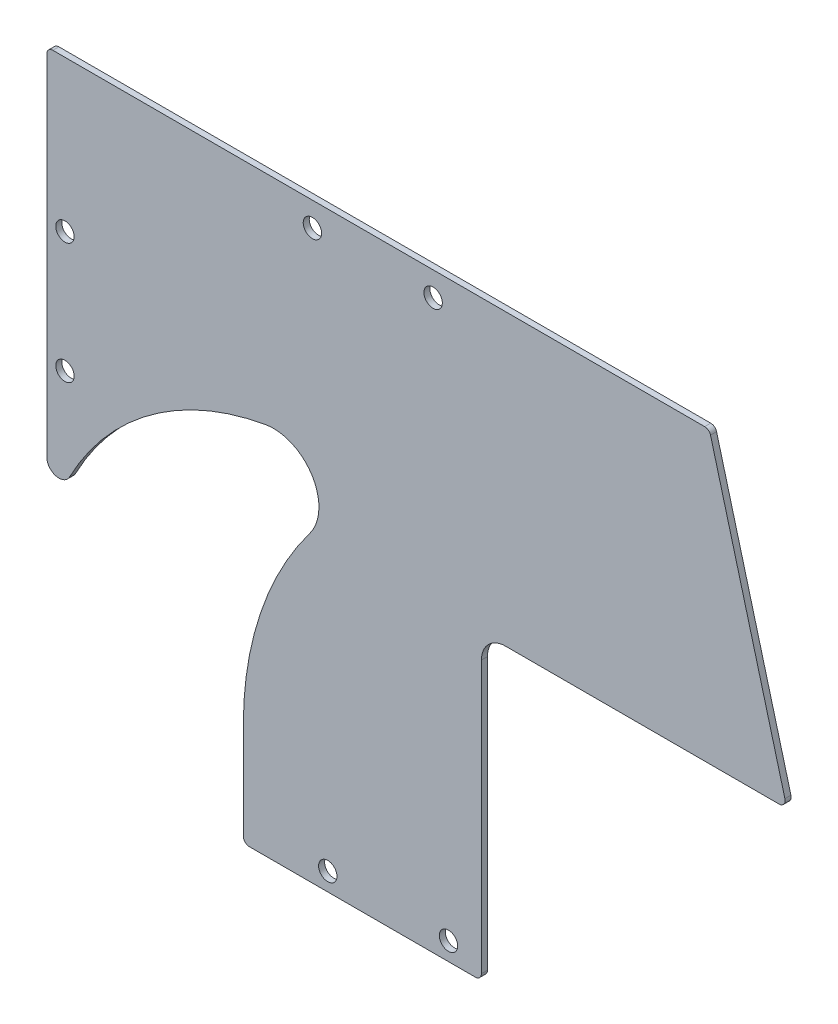
from build123d import *

# Parameters (mm, degrees)
SKETCH_1_W          = 140
SKETCH_1_H          = 103
EXTRUDE_1_DEPTH     = 0.5
CUT_EXTRUDE_1_DEPTH = 1.5
CUT_EXTRUDE_2_DEPTH = 1.5
SKETCH_4_W          = 33.363809018
SKETCH_4_H          = 55
CUT_EXTRUDE_3_DEPTH = 1
FILLET_1_R          = 2
SKETCH_6_R          = 1.525
CUT_EXTRUDE_5_DEPTH = 10
SKETCH_7_R          = 1.525
CUT_EXTRUDE_6_DEPTH = 10
SKETCH_8_R          = 1.525
SKETCH_8_W          = 39.445445888
SKETCH_8_H          = 5
CUT_EXTRUDE_7_DEPTH = 10
FILLET_2_R          = 1


with BuildPart() as part:
    # 草图1 → 凸台-拉伸1 (new, symmetric)
    with BuildSketch(Plane.XY):
        Rectangle(SKETCH_1_W, SKETCH_1_H)
    extrude(amount=EXTRUDE_1_DEPTH, both=True)

    # 草图2 → 切除-拉伸1 (cut, symmetric)
    with BuildSketch(Plane.XY.offset(0.5)):
        with BuildLine():
            Line((-71.445445888, -29.5), (-71.445445888, -77.5))
            ThreePointArc((-71.445445888, -77.5), (-69.980979794, -81.035533906), (-66.445445888, -82.5))
            Line((-66.445445888, -82.5), (-42.445445888, -82.5))
            ThreePointArc((-42.445445888, -82.5), (-38.909911982, -81.035533906), (-37.445445888, -77.5))
            Line((-37.445445888, -77.5), (-37.445445888, -29.5))
            ThreePointArc((-37.445445888, -29.5), (-34.619011221, -12.115704179), (-26.430867135, 3.477780697))
            ThreePointArc((-26.430867135, 3.477780697), (-26.030895398, 11.934357254), (-33.750115979, 15.411036429))
            ThreePointArc((-33.750115979, 15.411036429), (-60.772664783, -0.183029274), (-71.445445888, -29.5))
        make_face()
        with BuildLine():
            Line((6, -82.5), (34, -82.5))
            ThreePointArc((34, -82.5), (36.828427125, -81.328427125), (38, -78.5))
            Line((38, -78.5), (38, -0.5))
            ThreePointArc((38, -0.5), (36.828427125, 2.328427125), (34, 3.5))
            Line((34, 3.5), (6, 3.5))
            ThreePointArc((6, 3.5), (3.171572875, 2.328427125), (2, -0.5))
            Line((2, -0.5), (2, -78.5))
            ThreePointArc((2, -78.5), (3.171572875, -81.328427125), (6, -82.5))
        make_face()
    extrude(amount=CUT_EXTRUDE_1_DEPTH, both=True, mode=Mode.SUBTRACT)

    # 草图3 → 切除-拉伸2 (cut, symmetric)
    with BuildSketch(Plane.XY.offset(0.5)):
        Polygon((67.363809018, -51.5), (39.765042197, 51.5), (70, 51.5), (70, -51.5), align=None)
    extrude(amount=CUT_EXTRUDE_2_DEPTH, both=True, mode=Mode.SUBTRACT)

    # 草图4 → 切除-拉伸3 (cut, symmetric)
    with BuildSketch(Plane.XY.offset(0.5)):
        with Locations((50.681904509, -24)):
            Rectangle(SKETCH_4_W, SKETCH_4_H)
    extrude(amount=CUT_EXTRUDE_3_DEPTH, both=True, mode=Mode.SUBTRACT)

    # 圆角1
    fillet_1_edges = [part.edges().sort_by_distance(p)[0] for p in [
        (-70, -18.109646868, 0),
    ]]
    fillet(fillet_1_edges, radius=FILLET_1_R)

    # 草图6 → 切除-拉伸5 (cut)
    with BuildSketch(Plane.XY.offset(0.5)):
        with Locations((-26, 47.5)):
            Circle(SKETCH_6_R)
        with Locations((-6, 47.5)):
            Circle(SKETCH_6_R)
    extrude(amount=-CUT_EXTRUDE_5_DEPTH, mode=Mode.SUBTRACT)

    # 草图7 → 切除-拉伸6 (cut)
    with BuildSketch(Plane(origin=(0, 0, -0.5), x_dir=(-1, 0, 0), z_dir=(0, 0, -1))):
        with Locations((67, 6.5)):
            Circle(SKETCH_7_R)
        with Locations((67, 26.5)):
            Circle(SKETCH_7_R)
    extrude(amount=-CUT_EXTRUDE_6_DEPTH, mode=Mode.SUBTRACT)

    # 草图8 → 切除-拉伸7 (cut)
    with BuildSketch(Plane.XY.offset(0.5)):
        with Locations((-23.45, -43.5)):
            Circle(SKETCH_8_R)
        with Locations((-3.45, -43.5)):
            Circle(SKETCH_8_R)
        with Locations((-17.722722944, -49)):
            Rectangle(SKETCH_8_W, SKETCH_8_H)
    extrude(amount=-CUT_EXTRUDE_7_DEPTH, mode=Mode.SUBTRACT)

    # 圆角2
    fillet_2_edges = [part.edges().sort_by_distance(p)[0] for p in [
        (52.626603434, 3.5, 0),
        (-37.445445888, -46.5, 0),
        (2, -46.5, 0),
        (-70, 51.5, 0),
        (39.765042197, 51.5, 0),
    ]]
    fillet(fillet_2_edges, radius=FILLET_2_R)


solid = part.part
